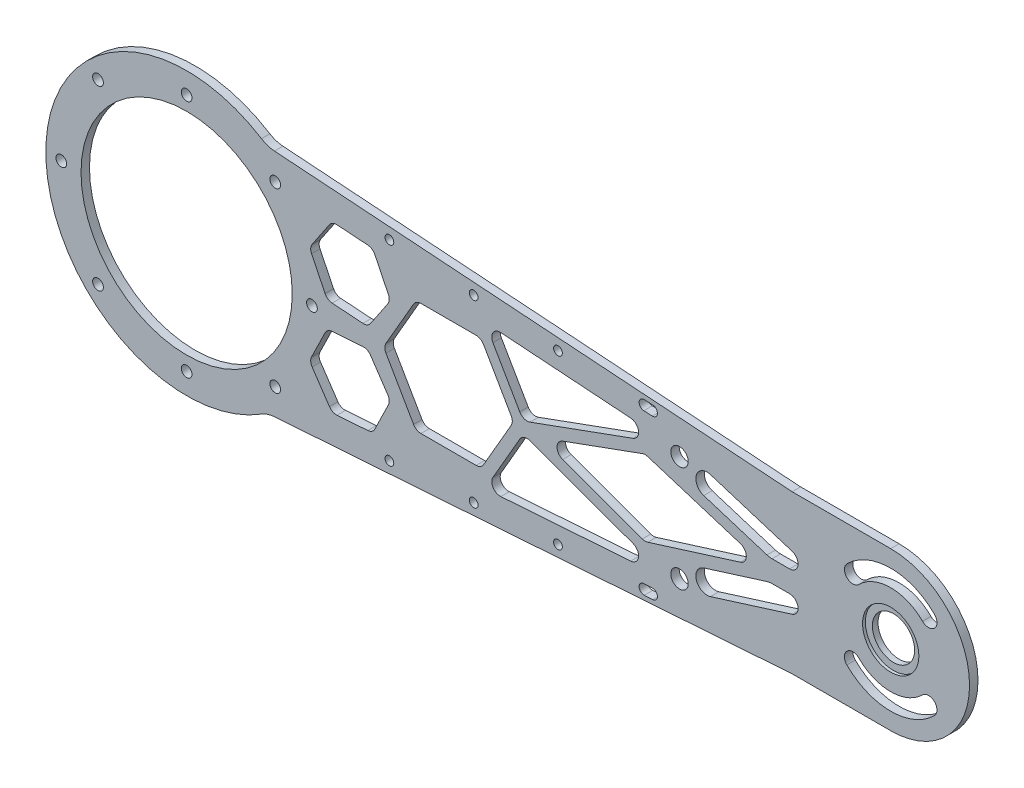
from build123d import *
from build123d.topology import SkipClean

# Parameters (mm, degrees)
EXTRUDE_1_DEPTH      = 3
SKETCH_3_R           = 7.5
CUT_EXTRUDE_2_DEPTH  = 10
SKETCH_4_R           = 10
CUT_EXTRUDE_3_DEPTH  = 1
SKETCH_5_R           = 1.55
CUT_EXTRUDE_4_DEPTH  = 10
SKETCH_6_R           = 3.1
CUT_EXTRUDE_5_DEPTH  = 10
CUT_EXTRUDE_7_DEPTH  = 9
CUT_EXTRUDE_9_DEPTH  = 10
SKETCH_2_R           = 1.9
SKETCH_2_R_2         = 37.5
CUT_EXTRUDE_12_DEPTH = 10
CUT_EXTRUDE_13_DEPTH = 10
EXTRUDE_2_DEPTH      = 3
CUT_EXTRUDE_14_DEPTH = 10
CUT_EXTRUDE_15_DEPTH = 10
FILLET_1_R           = 3
FILLET_2_R           = 6


with BuildPart() as part:
    # 草图1 → 凸台-拉伸1 (new body)
    with BuildSketch(Plane.XY):
        with BuildLine():
            ThreePointArc((250, -28), (278, 0), (250, 28))
            Line((250, 28), (215.69841539, 28))
            Line((215.69841539, 28), (215.349207695, 28))
            Line((215.349207695, 28), (215, 28))
            Line((215, 28), (214.651642957, 28.024359497))
            Line((214.651642957, 28.024359497), (213.91342496, 28.075980729))
            Line((213.91342496, 28.075980729), (31.183070535, 40.853731859))
            ThreePointArc((31.183070535, 40.853731859), (28.782473703, 41.321407548), (26.56719606, 42.357810301))
            ThreePointArc((26.56719606, 42.357810301), (13.822255332, 48.051485487), (0, 50))
            ThreePointArc((0, 50), (-50, 0), (0, -50))
            ThreePointArc((0, -50), (13.822255332, -48.051485487), (26.56719606, -42.357810301))
            ThreePointArc((26.56719606, -42.357810301), (28.782473703, -41.321407548), (31.183070535, -40.853731859))
            Line((31.183070535, -40.853731859), (213.91342496, -28.075980729))
            Line((213.91342496, -28.075980729), (214.651642957, -28.024359497))
            Line((214.651642957, -28.024359497), (215, -28))
            Line((215, -28), (215.349207695, -28))
            Line((215.349207695, -28), (215.69841539, -28))
            Line((215.69841539, -28), (250, -28))
        make_face()
    extrude(amount=EXTRUDE_1_DEPTH)

    # 草图3 → 切除-拉伸2 (cut)
    with BuildSketch(Plane.XY.offset(3)):
        with Locations((250, 0)):
            Circle(SKETCH_3_R)
    extrude(amount=-CUT_EXTRUDE_2_DEPTH, mode=Mode.SUBTRACT)

    # 草图4 → 切除-拉伸3 (cut)
    with BuildSketch(Plane.XY.offset(3)):
        with Locations((250, 0)):
            Circle(SKETCH_4_R)
    extrude(amount=-CUT_EXTRUDE_3_DEPTH, mode=Mode.SUBTRACT)

    # 草图5 → 切除-拉伸4 (cut)
    with BuildSketch(Plane.XY.offset(3)):
        with Locations((72, 33.989766516)):
            Circle(SKETCH_5_R)
        with Locations((101.926921508, 31.897072303)):
            Circle(SKETCH_5_R)
        with Locations((131.853843016, 29.804378091)):
            Circle(SKETCH_5_R)
        with Locations((131.853843016, -29.804378091)):
            Circle(SKETCH_5_R)
        with Locations((101.926921508, -31.897072303)):
            Circle(SKETCH_5_R)
        with Locations((72, -33.989766516)):
            Circle(SKETCH_5_R)
    extrude(amount=-CUT_EXTRUDE_4_DEPTH, mode=Mode.SUBTRACT)

    # 草图6 → 切除-拉伸5 (cut)
    with BuildSketch(Plane.XY.offset(3)):
        with Locations((175, -21)):
            Circle(SKETCH_6_R)
        with Locations((175, 21)):
            Circle(SKETCH_6_R)
    extrude(amount=-CUT_EXTRUDE_5_DEPTH, mode=Mode.SUBTRACT)

    # 草图8 → 切除-拉伸7 (cut)
    with BuildSketch(Plane.XY.offset(3)):
        with BuildLine():
            ThreePointArc((238.686291502, 11.3137085), (250, 16), (261.313708499, 11.313708499))
            ThreePointArc((261.313708499, 11.313708499), (265.556349186, 11.313708499), (265.556349186, 15.556349186))
            ThreePointArc((265.556349186, 15.556349186), (250, 22), (234.443650814, 15.556349186))
            ThreePointArc((234.443650814, 15.556349186), (234.443650814, 11.313708499), (238.686291502, 11.3137085))
        make_face()
        with BuildLine():
            ThreePointArc((234.443650814, -15.556349186), (249.999999954, -22), (265.556349121, -15.556349251))
            ThreePointArc((265.556349121, -15.556349251), (265.556349203, -11.313708516), (261.313708468, -11.31370853))
            ThreePointArc((261.313708468, -11.31370853), (249.999999987, -16), (238.686291514, -11.313708512))
            ThreePointArc((238.686291514, -11.313708512), (234.44365082, -11.313708493), (234.443650814, -15.556349186))
        make_face()
    extrude(amount=-CUT_EXTRUDE_7_DEPTH, mode=Mode.SUBTRACT)

    # 草图9 → 切除-拉伸9 (cut)
    with BuildSketch(Plane.XY.offset(3)):
        with BuildLine():
            Line((178.1, 21), (178.1, 5))
            ThreePointArc((178.1, 5), (175, 1.9), (171.9, 5))
            Line((171.9, 5), (171.9, 21))
            ThreePointArc((171.9, 21), (175, 24.1), (178.1, 21))
        make_face()
    extrude(amount=-CUT_EXTRUDE_9_DEPTH, mode=Mode.SUBTRACT)

    # 草图2 → 切除-拉伸12 (cut)
    with BuildSketch(Plane.XY.offset(3)):
        with Locations((-31.466251763, 31.466251763)):
            Circle(SKETCH_2_R)
        with Locations((31.466251763, 31.466251763)):
            Circle(SKETCH_2_R)
        with Locations((31.466251763, -31.466251763)):
            Circle(SKETCH_2_R)
        with Locations((-31.466251763, -31.466251763)):
            Circle(SKETCH_2_R)
        with Locations((-44.5, 0)):
            Circle(SKETCH_2_R)
        with Locations((44.5, 0)):
            Circle(SKETCH_2_R)
        Circle(SKETCH_2_R_2)
        with Locations((0, 42.5)):
            Circle(SKETCH_2_R)
        with Locations((0, -42.5)):
            Circle(SKETCH_2_R)
    extrude(amount=-CUT_EXTRUDE_12_DEPTH, mode=Mode.SUBTRACT)

    # 草图11 → 切除-拉伸13 (cut)
    with BuildSketch(Plane.XY.offset(3)):
        with BuildLine():
            ThreePointArc((162.502565585, 30.084208114), (160.670617885, 28.420186592), (162.334639407, 26.588238892))
            Line((162.334639407, 26.588238892), (163.832912222, 26.516270516))
            ThreePointArc((163.832912222, 26.516270516), (162.168890411, 28.348218281), (164.000838503, 30.012239733))
            Line((164.000838503, 30.012239733), (162.502565585, 30.084208114))
        make_face()
        with BuildLine():
            Line((165.499110632, 29.94027139), (164.000838503, 30.012239733))
            ThreePointArc((164.000838503, 30.012239733), (165.664859628, 28.180292001), (163.832912222, 26.516270516))
            Line((163.832912222, 26.516270516), (165.331184454, 26.444302168))
            ThreePointArc((165.331184454, 26.444302168), (167.163132154, 28.10832369), (165.499110632, 29.94027139))
        make_face()
        with BuildLine():
            ThreePointArc((162.334639407, -26.588238892), (160.670617885, -28.420186592), (162.502565585, -30.084208114))
            Line((162.502565585, -30.084208114), (165.499110632, -29.94027139))
            ThreePointArc((165.499110632, -29.94027139), (167.163132154, -28.10832369), (165.331184454, -26.444302168))
            Line((165.331184454, -26.444302168), (162.334639407, -26.588238892))
        make_face()
    extrude(amount=-CUT_EXTRUDE_13_DEPTH, mode=Mode.SUBTRACT)


with BuildPart() as cut_extrude_13_kept_piece:
    # of the separate pieces the step leaves, the one the design keeps (cut_extrude_13_pieces_kept)
    add(part.part.solids().sort_by_distance((31.183070535, -40.853731859, 0))[0])

    # 草图12 → 凸台-拉伸2 (add)
    with BuildSketch(Plane.XY.offset(3)):
        with BuildLine():
            ThreePointArc((171.9, 5), (175, 1.9), (178.1, 5))
            Line((178.1, 5), (178.1, 18.8))
            ThreePointArc((178.1, 18.8), (175, 15.7), (171.9, 18.8))
            Line((171.9, 18.8), (171.9, 5))
        make_face()
        with BuildLine():
            ThreePointArc((171.9, 18.8), (175, 21.9), (178.1, 18.8))
            Line((178.1, 18.8), (178.1, 21))
            ThreePointArc((178.1, 21), (175, 24.1), (171.9, 21))
            Line((171.9, 21), (171.9, 18.8))
        make_face()
        with BuildLine():
            ThreePointArc((172.101724651, -19.9), (175, -24.1), (177.898275349, -19.9))
            ThreePointArc((177.898275349, -19.9), (175, -21.9), (172.101724651, -19.9))
        make_face()
    extrude(amount=-EXTRUDE_2_DEPTH)

    # 草图12<9> → 切除-拉伸14 (cut)
    with SkipClean():  # the faces are left unmerged after this step: merging them gives an invalid solid
        with BuildSketch(Plane.XY.offset(3)):
            with BuildLine():
                ThreePointArc((178.1, -18.8), (175, -15.7), (171.9, -18.8))
                ThreePointArc((171.9, -18.8), (171.950848185, -19.359171895), (172.101724651, -19.9))
                ThreePointArc((172.101724651, -19.9), (175, -17.9), (177.898275349, -19.9))
                ThreePointArc((177.898275349, -19.9), (178.049151815, -19.359171895), (178.1, -18.8))
            make_face()
        extrude(amount=-CUT_EXTRUDE_14_DEPTH, mode=Mode.SUBTRACT)

    # 草图14 → 切除-拉伸15 (cut)
    with SkipClean():  # the faces are left unmerged after this step: merging them gives an invalid solid
        with BuildSketch(Plane.XY.offset(3)):
            with BuildLine():
                ThreePointArc((111.559689545, 25.208832156), (108.806275836, 23.805897798), (108.752343913, 20.716140005))
                Line((108.752343913, 20.716140005), (118.299576733, 4.179847688))
                ThreePointArc((118.299576733, 4.179847688), (119.871467008, 2.86081551), (121.923462354, 2.860678475))
                Line((121.923462354, 2.860678475), (158.504429018, 16.171372861))
                ThreePointArc((158.504429018, 16.171372861), (160.4494424, 19.407929114), (157.687889029, 21.983234225))
                Line((157.687889029, 21.983234225), (111.559689545, 25.208832156))
            make_face()
            with BuildLine():
                ThreePointArc((71.430046304, 13.980783599), (71.935625737, 15.449092888), (71.639315725, 16.97347575))
                Line((71.639315725, 16.97347575), (66.830535433, 26.832936457))
                ThreePointArc((66.830535433, 26.832936457), (65.811732004, 28.004935734), (64.343422715, 28.510515167))
                Line((64.343422715, 28.510515167), (53.400489129, 29.275719626))
                ThreePointArc((53.400489129, 29.275719626), (51.876106267, 28.979409614), (50.70410699, 27.960606186))
                Line((50.70410699, 27.960606186), (44.569953696, 18.866349938))
                ThreePointArc((44.569953696, 18.866349938), (44.064374263, 17.398040649), (44.360684275, 15.873657787))
                Line((44.360684275, 15.873657787), (49.169464567, 6.01419708))
                ThreePointArc((49.169464567, 6.01419708), (50.188267996, 4.842197803), (51.656577285, 4.33661837))
                Line((51.656577285, 4.33661837), (62.599510871, 3.571413911))
                ThreePointArc((62.599510871, 3.571413911), (64.123893733, 3.867723922), (65.29589301, 4.886527351))
                Line((65.29589301, 4.886527351), (71.430046304, 13.980783599))
            make_face()
            with BuildLine():
                ThreePointArc((64.343422715, -28.510515167), (65.811732004, -28.004935734), (66.830535433, -26.832936457))
                Line((66.830535433, -26.832936457), (71.639315725, -16.97347575))
                ThreePointArc((71.639315725, -16.97347575), (71.935625737, -15.449092888), (71.430046304, -13.980783599))
                Line((71.430046304, -13.980783599), (65.29589301, -4.886527351))
                ThreePointArc((65.29589301, -4.886527351), (64.123893733, -3.867723922), (62.599510871, -3.571413911))
                Line((62.599510871, -3.571413911), (51.656577285, -4.33661837))
                ThreePointArc((51.656577285, -4.33661837), (50.188267996, -4.842197803), (49.169464567, -6.01419708))
                Line((49.169464567, -6.01419708), (44.360684275, -15.873657787))
                ThreePointArc((44.360684275, -15.873657787), (44.064374263, -17.398040649), (44.569953696, -18.866349938))
                Line((44.569953696, -18.866349938), (50.70410699, -27.960606186))
                ThreePointArc((50.70410699, -27.960606186), (51.876106267, -28.979409614), (53.400489129, -29.275719626))
                Line((53.400489129, -29.275719626), (64.343422715, -28.510515167))
            make_face()
            with BuildLine():
                ThreePointArc((115.227985364, -1.5), (115.629909152, 0), (115.227985364, 1.5))
                Line((115.227985364, 1.5), (105.413030788, 18.5))
                ThreePointArc((105.413030788, 18.5), (104.314954576, 19.598076211), (102.814954576, 20))
                Line((102.814954576, 20), (83.185045424, 20))
                ThreePointArc((83.185045424, 20), (81.685045424, 19.598076211), (80.586969212, 18.5))
                Line((80.586969212, 18.5), (70.772014636, 1.5))
                ThreePointArc((70.772014636, 1.5), (70.370090848, 0), (70.772014636, -1.5))
                Line((70.772014636, -1.5), (80.586969212, -18.5))
                ThreePointArc((80.586969212, -18.5), (81.685045424, -19.598076211), (83.185045424, -20))
                Line((83.185045424, -20), (102.814954576, -20))
                ThreePointArc((102.814954576, -20), (104.314954576, -19.598076211), (105.413030788, -18.5))
                Line((105.413030788, -18.5), (115.227985364, -1.5))
            make_face()
            with BuildLine():
                Line((111.559689545, -25.208832156), (157.687889029, -21.983234225))
                ThreePointArc((157.687889029, -21.983234225), (160.4494424, -19.407929114), (158.504429018, -16.171372861))
                Line((158.504429018, -16.171372861), (121.923462354, -2.860678475))
                ThreePointArc((121.923462354, -2.860678475), (119.871467008, -2.86081551), (118.299576733, -4.179847688))
                Line((118.299576733, -4.179847688), (108.752343913, -20.716140005))
                ThreePointArc((108.752343913, -20.716140005), (108.806275836, -23.805897798), (111.559689545, -25.208832156))
            make_face()
            with BuildLine():
                Line((161.806024429, 13.116149245), (133.507464465, 2.819169214))
                ThreePointArc((133.507464465, 2.819169214), (131.533273875, 0), (133.507464465, -2.819169214))
                Line((133.507464465, -2.819169214), (161.806024429, -13.116149245))
                ThreePointArc((161.806024429, -13.116149245), (162.763517424, -13.296202075), (163.728215612, -13.159933002))
                Line((163.728215612, -13.159933002), (196.615731246, -2.862952971))
                ThreePointArc((196.615731246, -2.862952971), (198.719349473, 0), (196.615731246, 2.862952971))
                Line((196.615731246, 2.862952971), (163.728215612, 13.159933002))
                ThreePointArc((163.728215612, 13.159933002), (162.763517424, 13.296202075), (161.806024429, 13.116149245))
            make_face()
            with BuildLine():
                Line((233.729196096, 3.817270629), (186.013313238, 18.756966847))
                ThreePointArc((186.013313238, 18.756966847), (181.000866912, 16.134871916), (183.622961843, 11.12242559))
                Line((183.622961843, 11.12242559), (206.954889968, 3.817270629))
                Line((206.954889968, 3.817270629), (233.729196096, 3.817270629))
            make_face()
            with BuildLine():
                Line((186.013313238, -18.756966847), (233.729196096, -3.817270629))
                Line((233.729196096, -3.817270629), (206.954889968, -3.817270629))
                Line((206.954889968, -3.817270629), (183.622961843, -11.12242559))
                ThreePointArc((183.622961843, -11.12242559), (181.000866912, -16.134871916), (186.013313238, -18.756966847))
            make_face()
        extrude(amount=-CUT_EXTRUDE_15_DEPTH, mode=Mode.SUBTRACT)

    # 圆角1
    fillet_1_edges = [cut_extrude_13_kept_piece.edges().sort_by_distance(p)[0] for p in [
        (233.729196096, -3.817270629, 1.5),
        (233.729196096, 3.817270629, 1.5),
    ]]
    fillet(fillet_1_edges, radius=FILLET_1_R)

    # 圆角2
    fillet_2_edges = [cut_extrude_13_kept_piece.edges().sort_by_distance(p)[0] for p in [
        (206.954889968, -3.817270629, 1.5),
        (206.954889968, 3.817270629, 1.5),
    ]]
    fillet(fillet_2_edges, radius=FILLET_2_R)


solid = cut_extrude_13_kept_piece.part
